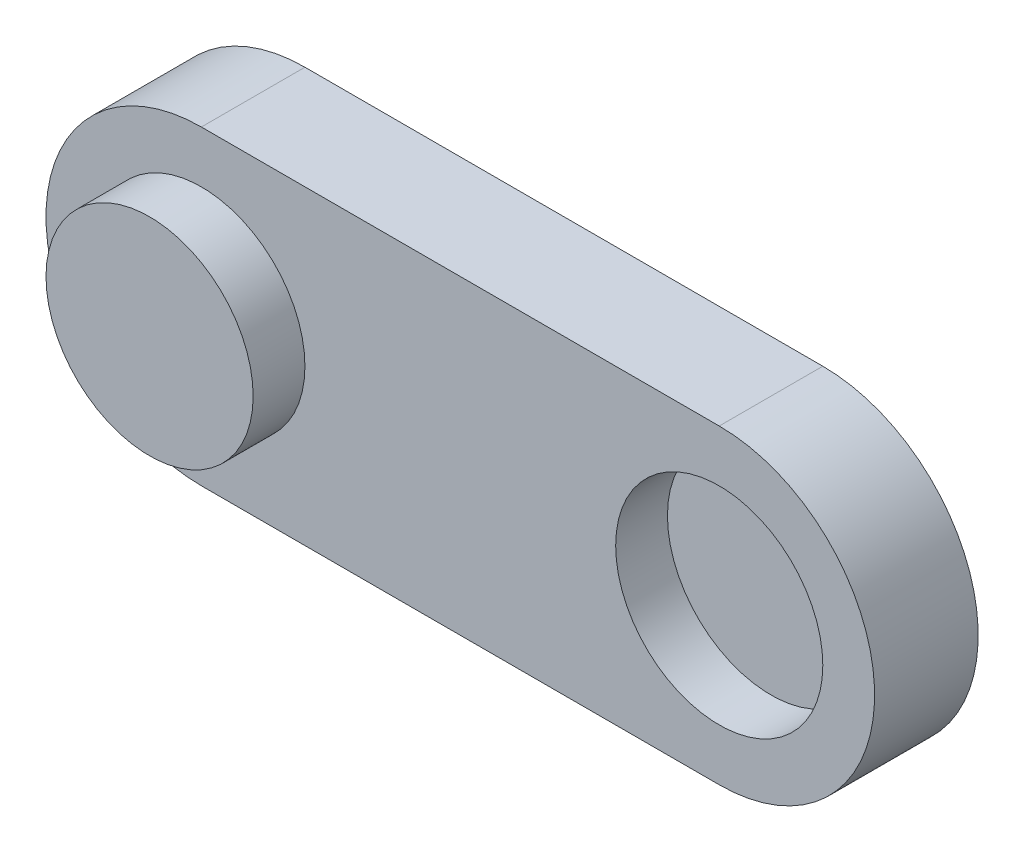
from build123d import *

# Parameters (mm, degrees)
SALIENTE_EXTRUIR1_DEPTH = 20
CROQUIS2_R              = 20
SALIENTE_EXTRUIR2_DEPTH = 10
CROQUIS3_R              = 20
CORTAR_EXTRUIR1_DEPTH   = 10


with BuildPart() as part:
    # Croquis1 → Saliente-Extruir1 (new body)
    with BuildSketch(Plane.XY):
        with BuildLine():
            Line((0, 30), (100, 30))
            ThreePointArc((100, 30), (130, 0), (100, -30))
            Line((100, -30), (0, -30))
            ThreePointArc((0, -30), (-30, 0), (0, 30))
        make_face()
    extrude(amount=SALIENTE_EXTRUIR1_DEPTH)

    # Croquis2 → Saliente-Extruir2 (add)
    with BuildSketch(Plane.XY.offset(20)):
        Circle(CROQUIS2_R)
    extrude(amount=SALIENTE_EXTRUIR2_DEPTH)

    # Croquis3 → Cortar-Extruir1 (cut)
    with BuildSketch(Plane.XY.offset(20)):
        with Locations((100, 0)):
            Circle(CROQUIS3_R)
    extrude(amount=-CORTAR_EXTRUIR1_DEPTH, mode=Mode.SUBTRACT)


solid = part.part
